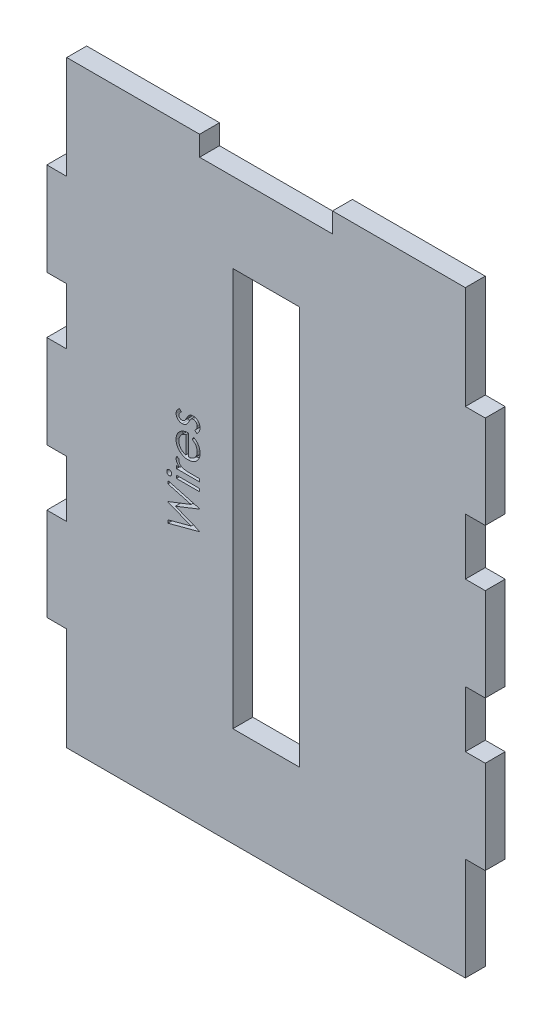
from build123d import *

# Parameters (mm, degrees)
ESQUISSE1_W             = 60
ESQUISSE1_H             = 90
ESQUISSE1_W_2           = 6
ESQUISSE1_H_2           = 14
BOSS_EXTRU_1_DEPTH      = 3
ESQUISSE2_W             = 10
ESQUISSE2_H             = 60
ENL_V_MAT_EXTRU_1_DEPTH = 10
ESQUISSE3_W             = 20
ESQUISSE3_H             = 6
ENL_V_MAT_EXTRU_2_DEPTH = 10
ESQUISSE4_W             = 3.480288462
ESQUISSE4_H             = 0.427403846
ENL_V_MAT_EXTRU_3_DEPTH = 1


with BuildPart() as part:
    # Esquisse1 → Boss.-Extru.1 (new body)
    with BuildSketch(Plane.XY):
        Rectangle(ESQUISSE1_W, ESQUISSE1_H)
        with Locations((-30, 0)):
            Rectangle(ESQUISSE1_W_2, ESQUISSE1_H_2)
        with Locations((-30, 22.5)):
            Rectangle(ESQUISSE1_W_2, ESQUISSE1_H_2)
        with Locations((30, 22.5)):
            Rectangle(ESQUISSE1_W_2, ESQUISSE1_H_2)
        with Locations((30, 0)):
            Rectangle(ESQUISSE1_W_2, ESQUISSE1_H_2)
        with Locations((30, -22.5)):
            Rectangle(ESQUISSE1_W_2, ESQUISSE1_H_2)
        with Locations((-30, -22.5)):
            Rectangle(ESQUISSE1_W_2, ESQUISSE1_H_2)
    extrude(amount=BOSS_EXTRU_1_DEPTH)

    # Esquisse2 → Enlèv. mat.-Extru.1 (cut)
    with BuildSketch(Plane.XY.offset(3)):
        Rectangle(ESQUISSE2_W, ESQUISSE2_H)
    extrude(amount=-ENL_V_MAT_EXTRU_1_DEPTH, mode=Mode.SUBTRACT)

    # Esquisse3 → Enlèv. mat.-Extru.2 (cut)
    with BuildSketch(Plane.XY.offset(3)):
        with Locations((0, 45)):
            Rectangle(ESQUISSE3_W, ESQUISSE3_H)
    extrude(amount=-ENL_V_MAT_EXTRU_2_DEPTH, mode=Mode.SUBTRACT)

    # Esquisse4 → Enlèv. mat.-Extru.3 (cut)
    # profile 1 of 6: a face of its own
    with BuildSketch(Plane.XY.offset(3)):
        with BuildLine():
            Line((-13.04620643, 7.723798077), (-12.747596154, 7.433774038))
            add(Edge.make_bspline(
                [(-12.747596154, 7.433774038), (-12.776597257, 7.408749818), (-12.832507968, 7.360506066), (-12.90726162, 7.283991086), (-12.970040812, 7.207758968), (-13.023043707, 7.132853261), (-13.063115581, 7.057390402), (-13.092363947, 6.982255953), (-13.110463904, 6.90737212), (-13.112796765, 6.857316836), (-13.113942308, 6.83273738)],
                knots=[0, 0, 0, 0, 1.26578478, 2.440284043, 3.530471711, 4.527705817, 5.468200915, 6.346673037, 7.188140097, 8, 8, 8, 8], degree=3))
            add(Edge.make_bspline(
                [(-13.113942308, 6.83273738), (-13.112475911, 6.802615269), (-13.109590251, 6.743339217), (-13.080915973, 6.658348102), (-13.03670568, 6.579863661), (-12.975200985, 6.511002383), (-12.903176137, 6.453201592), (-12.822354415, 6.411493618), (-12.735831438, 6.385423444), (-12.67590791, 6.382175944), (-12.645515325, 6.380528846)],
                knots=[0, 0, 0, 0, 0.999370852, 1.966620401, 2.952450547, 3.979894107, 5.019529251, 6.00881856, 6.990093614, 8, 8, 8, 8], degree=3))
            add(Edge.make_bspline(
                [(-12.645515325, 6.380528846), (-12.618012507, 6.382040344), (-12.563084403, 6.38505908), (-12.482056543, 6.408526882), (-12.403057501, 6.445900359), (-12.354666547, 6.480830159), (-12.329732572, 6.498828125)],
                knots=[0, 0, 0, 0, 0.960159726, 1.917612774, 2.927026955, 4, 4, 4, 4], degree=3))
            add(Edge.make_bspline(
                [(-12.329732572, 6.498828125), (-12.316477521, 6.509719905), (-12.288094991, 6.533042054), (-12.247702787, 6.575344229), (-12.205467195, 6.625455452), (-12.161674756, 6.683851485), (-12.116279592, 6.750649702), (-12.068510579, 6.82487118), (-12.019766032, 6.90743324), (-11.987718016, 6.965578119), (-11.97101863, 6.995875901)],
                knots=[0, 0, 0, 0, 0.667332049, 1.428932371, 2.272176193, 3.217953793, 4.268659351, 5.415594948, 6.6533338, 8, 8, 8, 8], degree=3))
            add(Edge.make_bspline(
                [(-11.97101863, 6.995875901), (-11.950283396, 7.032912432), (-11.910229752, 7.104454814), (-11.847914513, 7.206001139), (-11.786393954, 7.298704296), (-11.72426148, 7.381284298), (-11.66407288, 7.455677484), (-11.604164273, 7.520688429), (-11.544377316, 7.576518485), (-11.502549862, 7.60774538), (-11.482557091, 7.622671274)],
                knots=[0, 0, 0, 0, 1.271974443, 2.457035787, 3.569878245, 4.604907449, 5.553098313, 6.436573686, 7.252710343, 8, 8, 8, 8], degree=3))
            add(Edge.make_bspline(
                [(-11.482557091, 7.622671274), (-11.442203288, 7.647487554), (-11.361639164, 7.697031876), (-11.229132147, 7.748192182), (-11.088980845, 7.778702449), (-10.993297655, 7.782777128), (-10.944486178, 7.784855769)],
                knots=[0, 0, 0, 0, 0.995432674, 1.98732596, 2.973261739, 4, 4, 4, 4], degree=3))
            add(Edge.make_bspline(
                [(-10.944486178, 7.784855769), (-10.910102149, 7.78387661), (-10.842344663, 7.781947069), (-10.742556064, 7.768534197), (-10.64712609, 7.745459128), (-10.555000731, 7.714050459), (-10.4680138, 7.671559814), (-10.383931023, 7.622173693), (-10.305292466, 7.561836278), (-10.230724985, 7.494046876), (-10.162521974, 7.419416199), (-10.102847569, 7.339488111), (-10.05177832, 7.255382616), (-10.010847404, 7.165880651), (-9.978010359, 7.072092654), (-9.955361333, 6.973547332), (-9.941784743, 6.870642083), (-9.939901766, 6.800660273), (-9.938942308, 6.765001502)],
                knots=[0, 0, 0, 0, 1.03294705, 2.035535002, 3.018074688, 3.978914202, 4.953244146, 5.921606783, 6.903774788, 7.924990491, 8.946206195, 9.936011882, 10.917482605, 11.896392379, 12.887442265, 13.897874922, 14.928876017, 16, 16, 16, 16], degree=3))
            add(Edge.make_bspline(
                [(-9.938942308, 6.765001502), (-9.940286971, 6.716874493), (-9.942957614, 6.621289196), (-9.968229362, 6.479960215), (-10.007098934, 6.3415689), (-10.062516264, 6.208103695), (-10.130646791, 6.081603497), (-10.211256268, 5.965178249), (-10.303918595, 5.860039276), (-10.374793778, 5.799981041), (-10.41023137, 5.769951923)],
                knots=[0, 0, 0, 0, 1.014105853, 2.01412079, 3.018242674, 4.040740662, 5.055023907, 6.042888753, 7.021444376, 8, 8, 8, 8], degree=3))
            Line((-10.41023137, 5.769951923), (-10.732692308, 6.053297776))
            add(Edge.make_bspline(
                [(-10.732692308, 6.053297776), (-10.703634575, 6.080202381), (-10.647301765, 6.132361026), (-10.572293287, 6.215774467), (-10.509426558, 6.300655009), (-10.456843911, 6.386155065), (-10.416328095, 6.473540265), (-10.387863865, 6.562320904), (-10.369570161, 6.652316403), (-10.367422569, 6.712762237), (-10.366346154, 6.743058894)],
                knots=[0, 0, 0, 0, 1.179806542, 2.287233372, 3.337373186, 4.324005949, 5.273901747, 6.200048787, 7.097828587, 8, 8, 8, 8], degree=3))
            add(Edge.make_bspline(
                [(-10.366346154, 6.743058894), (-10.368211621, 6.784312624), (-10.371856431, 6.864915492), (-10.404942708, 6.980367897), (-10.456835433, 7.086948314), (-10.530395909, 7.179569867), (-10.615978097, 7.257951594), (-10.712028825, 7.315851885), (-10.816831102, 7.350935293), (-10.88952676, 7.355260472), (-10.926359675, 7.357451923)],
                knots=[0, 0, 0, 0, 1.072236613, 2.094970478, 3.102399718, 4.141104368, 5.155589565, 6.110053346, 7.042415349, 8, 8, 8, 8], degree=3))
            add(Edge.make_bspline(
                [(-10.926359675, 7.357451923), (-10.956730217, 7.356019423), (-11.01638425, 7.353205697), (-11.102931269, 7.329730339), (-11.185498127, 7.294224036), (-11.233852629, 7.258309687), (-11.258360877, 7.240106671)],
                knots=[0, 0, 0, 0, 1.014054094, 1.991812201, 2.982159616, 4, 4, 4, 4], degree=3))
            add(Edge.make_bspline(
                [(-11.258360877, 7.240106671), (-11.270658795, 7.229192846), (-11.297448102, 7.205418595), (-11.336060421, 7.161754259), (-11.377944993, 7.109888628), (-11.42056801, 7.047518057), (-11.467785901, 6.977789334), (-11.514610826, 6.896978228), (-11.565679851, 6.808216818), (-11.599431651, 6.745377969), (-11.61707482, 6.712530048)],
                knots=[0, 0, 0, 0, 0.615029206, 1.339755737, 2.178261527, 3.109653826, 4.166232585, 5.329982127, 6.604294388, 8, 8, 8, 8], degree=3))
            add(Edge.make_bspline(
                [(-11.61707482, 6.712530048), (-11.636858424, 6.677088013), (-11.675225146, 6.608354596), (-11.734982384, 6.510999175), (-11.795761783, 6.423168668), (-11.854153896, 6.342749672), (-11.913237395, 6.271773446), (-11.973077869, 6.210519602), (-12.031261993, 6.156576512), (-12.072487957, 6.126712355), (-12.092179988, 6.112447416)],
                knots=[0, 0, 0, 0, 1.262093308, 2.447601706, 3.550203992, 4.582594899, 5.537233252, 6.418365656, 7.244515135, 8, 8, 8, 8], degree=3))
            add(Edge.make_bspline(
                [(-12.092179988, 6.112447416), (-12.131851231, 6.087812604), (-12.210954503, 6.038691526), (-12.343151294, 5.990149623), (-12.482700601, 5.957703807), (-12.579175734, 5.954670751), (-12.628342849, 5.953125)],
                knots=[0, 0, 0, 0, 0.984940175, 1.963941237, 2.962352981, 4, 4, 4, 4], degree=3))
            add(Edge.make_bspline(
                [(-12.628342849, 5.953125), (-12.660490689, 5.953850923), (-12.723408568, 5.955271657), (-12.815847919, 5.966639105), (-12.903701308, 5.987261134), (-12.988437443, 6.01345492), (-13.068579829, 6.048999897), (-13.14449902, 6.092357736), (-13.216277692, 6.142916972), (-13.282944521, 6.201229288), (-13.343538204, 6.265311522), (-13.396230996, 6.334614073), (-13.441574127, 6.407169666), (-13.477947261, 6.48444881), (-13.50683896, 6.56554319), (-13.526412389, 6.651063291), (-13.53957745, 6.740423526), (-13.540748095, 6.801522944), (-13.541346154, 6.83273738)],
                knots=[0, 0, 0, 0, 1.087304385, 2.128008728, 3.143103065, 4.136477636, 5.123835063, 6.101831209, 7.089715868, 8.088492253, 9.092987035, 10.067605355, 11.028834439, 11.98153898, 12.951158004, 13.934816901, 14.944940436, 16, 16, 16, 16], degree=3))
            add(Edge.make_bspline(
                [(-13.541346154, 6.83273738), (-13.539843462, 6.869738009), (-13.536809888, 6.944433361), (-13.512717502, 7.056494477), (-13.473075671, 7.16839056), (-13.418325654, 7.280409119), (-13.347477512, 7.391729548), (-13.261848715, 7.503331057), (-13.162002611, 7.616553412), (-13.085667594, 7.68725111), (-13.04620643, 7.723798077)],
                knots=[0, 0, 0, 0, 0.845714091, 1.707292901, 2.609013841, 3.555613372, 4.552488639, 5.621697636, 6.770543573, 8, 8, 8, 8], degree=3))
        make_face()
    # profile 2 of 6: a face of its own
    with BuildSketch(Plane.XY.offset(3)):
        with BuildLine():
            Line((-11.099038462, 4.657557091), (-10.899646935, 5.037259615))
            add(Edge.make_bspline(
                [(-10.899646935, 5.037259615), (-10.845988554, 5.006986089), (-10.741590592, 4.948085794), (-10.598152299, 4.847206625), (-10.469881118, 4.740487889), (-10.358831039, 4.624682561), (-10.26076003, 4.503280345), (-10.176168301, 4.373975434), (-10.103529511, 4.237823267), (-10.044008801, 4.093324194), (-9.997216178, 3.940651312), (-9.962659508, 3.778918704), (-9.942619922, 3.607362729), (-9.940187719, 3.48988143), (-9.938942308, 3.42972506)],
                knots=[0, 0, 0, 0, 1.120611642, 2.180266485, 3.186550691, 4.152466804, 5.095166165, 6.022949561, 6.960161436, 7.899497276, 8.862391909, 9.862399089, 10.905440174, 12, 12, 12, 12], degree=3))
            add(Edge.make_bspline(
                [(-9.938942308, 3.42972506), (-9.940503286, 3.362856869), (-9.943548301, 3.232416401), (-9.969799833, 3.042542672), (-10.012624723, 2.863772826), (-10.072449255, 2.696116881), (-10.150591465, 2.539985531), (-10.245786223, 2.39506803), (-10.357545164, 2.260603898), (-10.486833846, 2.140824268), (-10.625199688, 2.0330102), (-10.769354588, 1.937809757), (-10.918799322, 1.85858934), (-11.072644725, 1.793163504), (-11.2305412, 1.741554917), (-11.393393039, 1.70488106), (-11.560554486, 1.683935382), (-11.673623868, 1.680711287), (-11.730603966, 1.679086538)],
                knots=[0, 0, 0, 0, 1.14524686, 2.234044844, 3.276713788, 4.290115724, 5.276966211, 6.260758605, 7.254862358, 8.264742877, 9.274005885, 10.257798278, 11.220590477, 12.167824544, 13.118936889, 14.062732937, 15.023735098, 16, 16, 16, 16], degree=3))
            add(Edge.make_bspline(
                [(-11.730603966, 1.679086538), (-11.784073003, 1.680527727), (-11.890041574, 1.683383973), (-12.046885047, 1.701387294), (-12.199323763, 1.733293722), (-12.347484387, 1.777076505), (-12.491118848, 1.83361588), (-12.630314563, 1.902784007), (-12.764923414, 1.984688635), (-12.849836249, 2.047924666), (-12.892608173, 2.079777644)],
                knots=[0, 0, 0, 0, 1.024358464, 2.0301432, 3.019427413, 4.004406732, 4.986367066, 5.972626655, 6.978780325, 8, 8, 8, 8], degree=3))
            add(Edge.make_bspline(
                [(-12.892608173, 2.079777644), (-12.944222323, 2.12284836), (-13.045649826, 2.20748707), (-13.177706907, 2.35212659), (-13.290670452, 2.506635398), (-13.382826334, 2.672567667), (-13.453708779, 2.849643892), (-13.504126524, 3.036950729), (-13.535498748, 3.235005889), (-13.539367385, 3.370774867), (-13.541346154, 3.440219351)],
                knots=[0, 0, 0, 0, 1.030811313, 2.025658015, 2.997072178, 3.962767568, 4.930766827, 5.917075773, 6.934604948, 8, 8, 8, 8], degree=3))
            add(Edge.make_bspline(
                [(-13.541346154, 3.440219351), (-13.539512908, 3.51158966), (-13.535916498, 3.651601938), (-13.502276713, 3.855694809), (-13.449577969, 4.049190974), (-13.3727984, 4.230493609), (-13.277624881, 4.40239632), (-13.157330009, 4.560942787), (-13.018092271, 4.710485212), (-12.910900906, 4.797437419), (-12.856355168, 4.841684195)],
                knots=[0, 0, 0, 0, 1.056389096, 2.072394598, 3.055233004, 4.020130009, 4.981825462, 5.957811105, 6.960805292, 8, 8, 8, 8], degree=3))
            add(Edge.make_bspline(
                [(-12.856355168, 4.841684195), (-12.815256724, 4.871792636), (-12.733333398, 4.931809107), (-12.599750502, 5.006984625), (-12.459990729, 5.072240938), (-12.311794932, 5.124401145), (-12.156919003, 5.166637038), (-11.994255755, 5.197194352), (-11.823853625, 5.21511444), (-11.707748562, 5.218636918), (-11.648557692, 5.220432692)],
                knots=[0, 0, 0, 0, 0.94817472, 1.890038105, 2.849395472, 3.817997239, 4.812318967, 5.836947057, 6.897266129, 8, 8, 8, 8], degree=3))
            Line((-11.648557692, 5.220432692), (-11.648557692, 2.106490385))
            add(Edge.make_bspline(
                [(-11.648557692, 2.106490385), (-11.602700989, 2.108585349), (-11.512525632, 2.112705012), (-11.380576102, 2.131911689), (-11.254882376, 2.162185913), (-11.136387237, 2.204734174), (-11.023543027, 2.256260131), (-10.917186827, 2.319377838), (-10.817803072, 2.39467916), (-10.724502789, 2.478670201), (-10.641416539, 2.572160927), (-10.567051086, 2.670517094), (-10.504722756, 2.775147266), (-10.454131549, 2.885226444), (-10.414526169, 3.000576623), (-10.387491741, 3.121234146), (-10.369384571, 3.246961583), (-10.367371169, 3.332667171), (-10.366346154, 3.376299579)],
                knots=[0, 0, 0, 0, 1.094153842, 2.151609401, 3.174256925, 4.172055639, 5.149267565, 6.128595816, 7.11444997, 8.118368179, 9.117203808, 10.09244225, 11.054858984, 12.015122123, 12.976791628, 13.957293641, 14.960065497, 16, 16, 16, 16], degree=3))
            add(Edge.make_bspline(
                [(-10.366346154, 3.376299579), (-10.367166883, 3.418961395), (-10.368795366, 3.503610621), (-10.384857291, 3.62964094), (-10.410314049, 3.753848057), (-10.446979522, 3.874998627), (-10.489914297, 3.991327034), (-10.54044825, 4.099648625), (-10.598062676, 4.198531333), (-10.663534255, 4.291310732), (-10.743885077, 4.380814989), (-10.843191671, 4.471009268), (-10.962580373, 4.565586701), (-11.05184075, 4.62574665), (-11.099038462, 4.657557091)],
                knots=[0, 0, 0, 0, 0.991168677, 1.966668791, 2.94808785, 3.9350306, 4.905702032, 5.828266021, 6.709360349, 7.562606342, 8.463112863, 9.498839253, 10.677475166, 12, 12, 12, 12], degree=3))
        make_face()
        with BuildLine():
            add(Edge.make_bspline(
                [(-12.075961538, 4.793028846), (-12.132681136, 4.777448575), (-12.241564337, 4.747539516), (-12.392288563, 4.683842977), (-12.527015301, 4.613836881), (-12.643505692, 4.529563318), (-12.747130383, 4.435011612), (-12.836238899, 4.324289279), (-12.918368511, 4.202198472), (-12.986762925, 4.06630739), (-13.042966671, 3.9219749), (-13.084293798, 3.772167604), (-13.108587121, 3.618140275), (-13.112148854, 3.514399137), (-13.113942308, 3.462161959)],
                knots=[0, 0, 0, 0, 1.155085888, 2.217389643, 3.210301801, 4.133263417, 5.03575695, 5.95948047, 6.920061569, 7.923798377, 8.943125483, 9.960783337, 10.973185325, 12, 12, 12, 12], degree=3))
            add(Edge.make_bspline(
                [(-13.113942308, 3.462161959), (-13.113119703, 3.419501071), (-13.111493587, 3.335169463), (-13.095745788, 3.210981893), (-13.070440824, 3.091408672), (-13.033233771, 2.976806722), (-12.987960141, 2.866415845), (-12.932309689, 2.760315807), (-12.865027319, 2.659870545), (-12.813630668, 2.597092398), (-12.787665264, 2.565377103)],
                knots=[0, 0, 0, 0, 1.048823158, 2.073302879, 3.073550078, 4.050623576, 5.03253758, 6.005186856, 6.992227572, 8, 8, 8, 8], degree=3))
            add(Edge.make_bspline(
                [(-12.787665264, 2.565377103), (-12.767128372, 2.542658756), (-12.725566708, 2.496682358), (-12.653919701, 2.435314569), (-12.576616775, 2.376118885), (-12.490283587, 2.323514894), (-12.397423704, 2.27352261), (-12.297359553, 2.227966677), (-12.189668758, 2.186545114), (-12.114589018, 2.16329268), (-12.075961538, 2.151329627)],
                knots=[0, 0, 0, 0, 0.879905587, 1.780714457, 2.708106151, 3.677566983, 4.684151534, 5.740052498, 6.837288539, 8, 8, 8, 8], degree=3))
            Line((-12.075961538, 2.151329627), (-12.075961538, 4.793028846))
        make_face(mode=Mode.SUBTRACT)
    # profile 3 of 6: a face of its own
    with BuildSketch(Plane.XY.offset(3)):
        with BuildLine():
            Line((-13.480288462, -0.335817308), (-13.480288462, 0.091586538))
            Line((-13.480288462, 0.091586538), (-12.967976262, 0.091586538))
            add(Edge.make_bspline(
                [(-12.967976262, 0.091586538), (-13.015698583, 0.123119625), (-13.106967151, 0.183426407), (-13.227513672, 0.284132623), (-13.328461192, 0.386185615), (-13.407884628, 0.492265107), (-13.46790935, 0.601331072), (-13.510086842, 0.712463815), (-13.536242389, 0.825935094), (-13.53964262, 0.902373848), (-13.541346154, 0.940670072)],
                knots=[0, 0, 0, 0, 1.280091057, 2.448164201, 3.510831157, 4.48793739, 5.405868014, 6.289422536, 7.142991551, 8, 8, 8, 8], degree=3))
            add(Edge.make_bspline(
                [(-13.541346154, 0.940670072), (-13.539726187, 0.970369466), (-13.536393001, 1.0314779), (-13.512973986, 1.123982781), (-13.475584248, 1.219291907), (-13.440423088, 1.280717798), (-13.422092849, 1.312740385)],
                knots=[0, 0, 0, 0, 0.901110191, 1.854092781, 2.881294221, 4, 4, 4, 4], degree=3))
            Line((-13.422092849, 1.312740385), (-13.051930589, 1.07804988))
            add(Edge.make_bspline(
                [(-13.051930589, 1.07804988), (-13.061102165, 1.057490819), (-13.078511573, 1.018465786), (-13.099115523, 0.961377608), (-13.111247537, 0.90874336), (-13.113085477, 0.875210518), (-13.113942308, 0.859577825)],
                knots=[0, 0, 0, 0, 1.180555205, 2.24091978, 3.179933427, 4, 4, 4, 4], degree=3))
            add(Edge.make_bspline(
                [(-13.113942308, 0.859577825), (-13.111674159, 0.825269725), (-13.107047794, 0.755291148), (-13.070157925, 0.652895583), (-13.012269304, 0.552644448), (-12.946351279, 0.473793458), (-12.883031252, 0.412524761), (-12.827612266, 0.368461868), (-12.76489585, 0.328914766), (-12.697306134, 0.290553027), (-12.623146808, 0.254912075), (-12.542296891, 0.223061649), (-12.455424011, 0.193275368), (-12.395019272, 0.176501108), (-12.364077524, 0.167908654)],
                knots=[0, 0, 0, 0, 1.125322384, 2.295331465, 3.535939348, 4.916963136, 5.656144286, 6.429838446, 7.238666481, 8.090384391, 8.983239461, 9.940052224, 10.944811494, 12, 12, 12, 12], degree=3))
            add(Edge.make_bspline(
                [(-12.364077524, 0.167908654), (-12.336487612, 0.16145809), (-12.275071605, 0.147098933), (-12.172504501, 0.133510305), (-12.051402797, 0.119543412), (-11.911625811, 0.11000543), (-11.752636237, 0.100995534), (-11.575119956, 0.096018096), (-11.378589062, 0.091744903), (-11.241509534, 0.091641011), (-11.169636418, 0.091586538)],
                knots=[0, 0, 0, 0, 0.566841273, 1.261806378, 2.068780918, 3.007109044, 4.065315289, 5.256255371, 6.561408263, 8, 8, 8, 8], degree=3))
            Line((-11.169636418, 0.091586538), (-10, 0.091586538))
            Line((-10, 0.091586538), (-10, -0.335817308))
            Line((-10, -0.335817308), (-13.480288462, -0.335817308))
        make_face()
    # profile 4 of 6: a face of its own
    with BuildSketch(Plane.XY.offset(3)):
        with BuildLine():
            add(Edge.make_bspline(
                [(-14.945673077, -1.406234976), (-14.944442784, -1.379712864), (-14.942033634, -1.327777475), (-14.921403195, -1.252675207), (-14.886433266, -1.184289773), (-14.839516272, -1.123632215), (-14.784340065, -1.071582327), (-14.72003139, -1.035141431), (-14.650555171, -1.011720278), (-14.60209321, -1.008891958), (-14.57741887, -1.007451923)],
                knots=[0, 0, 0, 0, 1.055194115, 2.066272739, 3.074728998, 4.095836921, 5.109056067, 6.073838105, 7.019297344, 8, 8, 8, 8], degree=3))
            add(Edge.make_bspline(
                [(-14.57741887, -1.007451923), (-14.553385046, -1.008924433), (-14.505873019, -1.011835412), (-14.437601259, -1.035123341), (-14.374186144, -1.071892886), (-14.319117071, -1.123598839), (-14.272226013, -1.184298617), (-14.237249208, -1.252672858), (-14.216620592, -1.327778093), (-14.214211191, -1.379713073), (-14.212980769, -1.406234976)],
                knots=[0, 0, 0, 0, 0.96129708, 1.900370562, 2.859976407, 3.87933698, 4.906634145, 5.921202961, 6.938410037, 8, 8, 8, 8], degree=3))
            add(Edge.make_bspline(
                [(-14.212980769, -1.406234976), (-14.21416421, -1.432453593), (-14.216467623, -1.483484706), (-14.237653968, -1.557462445), (-14.272237982, -1.625264783), (-14.318810041, -1.686040641), (-14.374524348, -1.736700296), (-14.437562558, -1.773573375), (-14.505882872, -1.79680752), (-14.553388356, -1.799725746), (-14.57741887, -1.801201923)],
                knots=[0, 0, 0, 0, 1.054934014, 2.053291228, 3.073705704, 4.106921865, 5.123545215, 6.088680038, 7.033164197, 8, 8, 8, 8], degree=3))
            add(Edge.make_bspline(
                [(-14.57741887, -1.801201923), (-14.602089776, -1.799758087), (-14.650544992, -1.796922303), (-14.720070734, -1.773555959), (-14.783999134, -1.737007435), (-14.839823117, -1.686007097), (-14.88642137, -1.62527371), (-14.920998455, -1.557460139), (-14.942186599, -1.483485316), (-14.944489764, -1.4324538), (-14.945673077, -1.406234976)],
                knots=[0, 0, 0, 0, 0.98631895, 1.937192651, 2.907499808, 3.917963147, 4.944918757, 5.95915025, 6.951458133, 8, 8, 8, 8], degree=3))
        make_face()
    # profile 5 of 6: a face of its own
    with BuildSketch(Plane.XY.offset(3)):
        with Locations((-11.740144231, -1.404326923)):
            Rectangle(ESQUISSE4_W, ESQUISSE4_H)
    # profile 6 of 6: a face of its own
    with BuildSketch(Plane.XY.offset(3)):
        Polygon((-14.7625, -8.090144231), (-14.7625, -7.648429988), (-11.269809195, -6.716346154), (-14.7625, -5.330145733), (-14.7625, -5.268134014), (-11.293659856, -3.907692308), (-14.7625, -2.970838341), (-14.7625, -2.533894231), (-10, -3.818013822), (-10, -3.879071514), (-13.642472957, -5.312019231), (-10, -6.762139423), (-10, -6.823197115), align=None)
    extrude(amount=-ENL_V_MAT_EXTRU_3_DEPTH, mode=Mode.SUBTRACT)


solid = part.part
